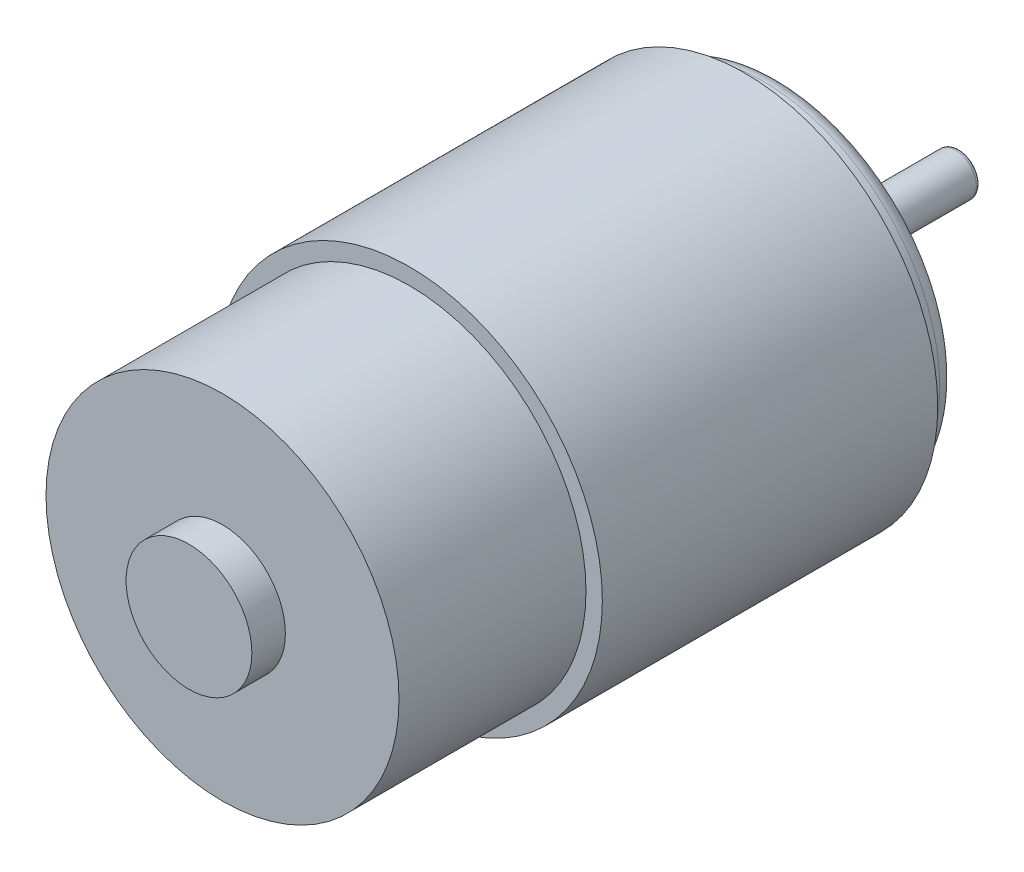
from build123d import *

# Parameters (mm, degrees)
SKETCH1_R           = 23
BOSS_EXTRUDE1_DEPTH = 40
SKETCH2_R           = 21.05
BOSS_EXTRUDE2_DEPTH = 22.3
BOSS_EXTRUDE3_START = 4.2
SKETCH3_R           = 21.05
BOSS_EXTRUDE3_DEPTH = 4.2
FILLET1_R           = 2
SKETCH4_R           = 7.5
BOSS_EXTRUDE4_DEPTH = 4.4
FILLET2_R           = 2
SKETCH5_R           = 2.5
BOSS_EXTRUDE5_DEPTH = 17
FILLET3_R           = 0.5
BOSS_EXTRUDE6_START = 4
SKETCH6_R           = 7.5
BOSS_EXTRUDE6_DEPTH = 4
SKETCH7_R           = 2.25
CUT_EXTRUDE1_DEPTH  = 0.7


with BuildPart() as part:
    # Sketch1 → Boss-Extrude1 (new body)
    with BuildSketch(Plane.XY):
        Circle(SKETCH1_R)
    extrude(amount=BOSS_EXTRUDE1_DEPTH)

    # Sketch2 → Boss-Extrude2 (add)
    with BuildSketch(Plane.XY.offset(40)):
        Circle(SKETCH2_R)
    extrude(amount=BOSS_EXTRUDE2_DEPTH)

    # Sketch3 → Boss-Extrude3 (add)
    with BuildSketch(Plane(origin=(0, 0, 0), x_dir=(-1, 0, 0), z_dir=(0, 0, -1)).offset(BOSS_EXTRUDE3_START)):
        with Locations(Location((0, 0, 0), (0, 0, 180))):
            Circle(SKETCH3_R)
    extrude(amount=-BOSS_EXTRUDE3_DEPTH)

    # Fillet1
    fillet1_edges = [part.edges().sort_by_distance(p)[0] for p in [
        (-21.05, 0, -4.2),
    ]]
    fillet(fillet1_edges, radius=FILLET1_R)

    # Sketch4 → Boss-Extrude4 (add)
    with BuildSketch(Plane(origin=(0, 0, -4.2), x_dir=(-1, 0, 0), z_dir=(0, 0, -1))):
        Circle(SKETCH4_R)
    extrude(amount=BOSS_EXTRUDE4_DEPTH)

    # Fillet2
    fillet2_edges = [part.edges().sort_by_distance(p)[0] for p in [
        (7.5, 0, -8.6),
    ]]
    fillet(fillet2_edges, radius=FILLET2_R)

    # Sketch5 → Boss-Extrude5 (add)
    with BuildSketch(Plane(origin=(0, 0, -8.6), x_dir=(-1, 0, 0), z_dir=(0, 0, -1))):
        Circle(SKETCH5_R)
    extrude(amount=BOSS_EXTRUDE5_DEPTH)

    # Fillet3
    fillet3_edges = [part.edges().sort_by_distance(p)[0] for p in [
        (2.5, 0, -25.6),
    ]]
    fillet(fillet3_edges, radius=FILLET3_R)

    # Sketch6 → Boss-Extrude6 (add)
    with BuildSketch(Plane.XY.offset(62.3).offset(BOSS_EXTRUDE6_START)):
        with Locations(Location((0, 0, 0), (0, 0, 180))):
            Circle(SKETCH6_R)
    extrude(amount=-BOSS_EXTRUDE6_DEPTH)

    # Sketch7 → Cut-Extrude1 (cut)
    with BuildSketch(Plane(origin=(0, 0, -4.2), x_dir=(-1, 0, 0), z_dir=(0, 0, -1))):
        with Locations((0, 14.5)):
            Circle(SKETCH7_R)
        with Locations((14.5, 0)):
            Circle(SKETCH7_R)
        with Locations((0, -14.5)):
            Circle(SKETCH7_R)
        with Locations((-14.5, 0)):
            Circle(SKETCH7_R)
    extrude(amount=-CUT_EXTRUDE1_DEPTH, mode=Mode.SUBTRACT)


solid = part.part
